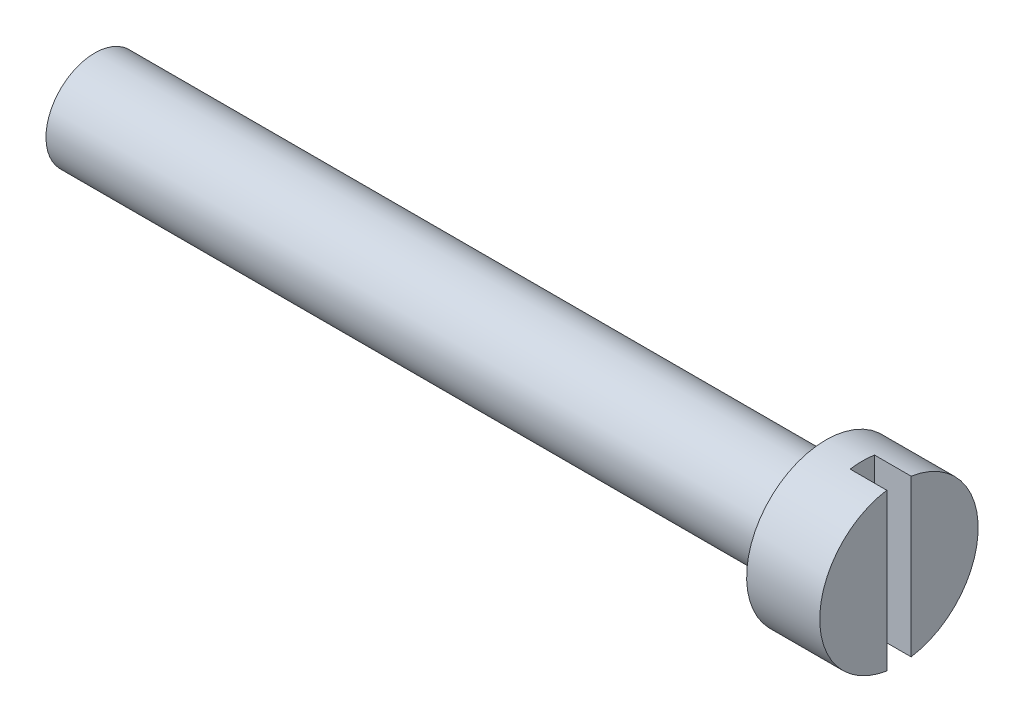
from build123d import *

# Parameters (mm, degrees)
SKETCH2_W          = 1
SKETCH2_H          = 6.5
CUT_EXTRUDE1_DEPTH = 1.5


with BuildPart() as part:
    # Sketch1 → Revolve1 (revolve)
    with BuildSketch(Plane.XY):
        Polygon((0, 0), (-33, 0), (-33, 2), (-3, 2), (-3, 3.25), (0, 3.25), align=None)
    revolve(axis=Axis((0, 0, 0), (-1, 0, 0)))

    # Sketch2 → Cut-Extrude1 (cut)
    with BuildSketch(Plane(origin=(0, 0, 0), x_dir=(0, 0, -1), z_dir=(1, 0, 0))):
        Rectangle(SKETCH2_W, SKETCH2_H)
    extrude(amount=-CUT_EXTRUDE1_DEPTH, mode=Mode.SUBTRACT)


solid = part.part
